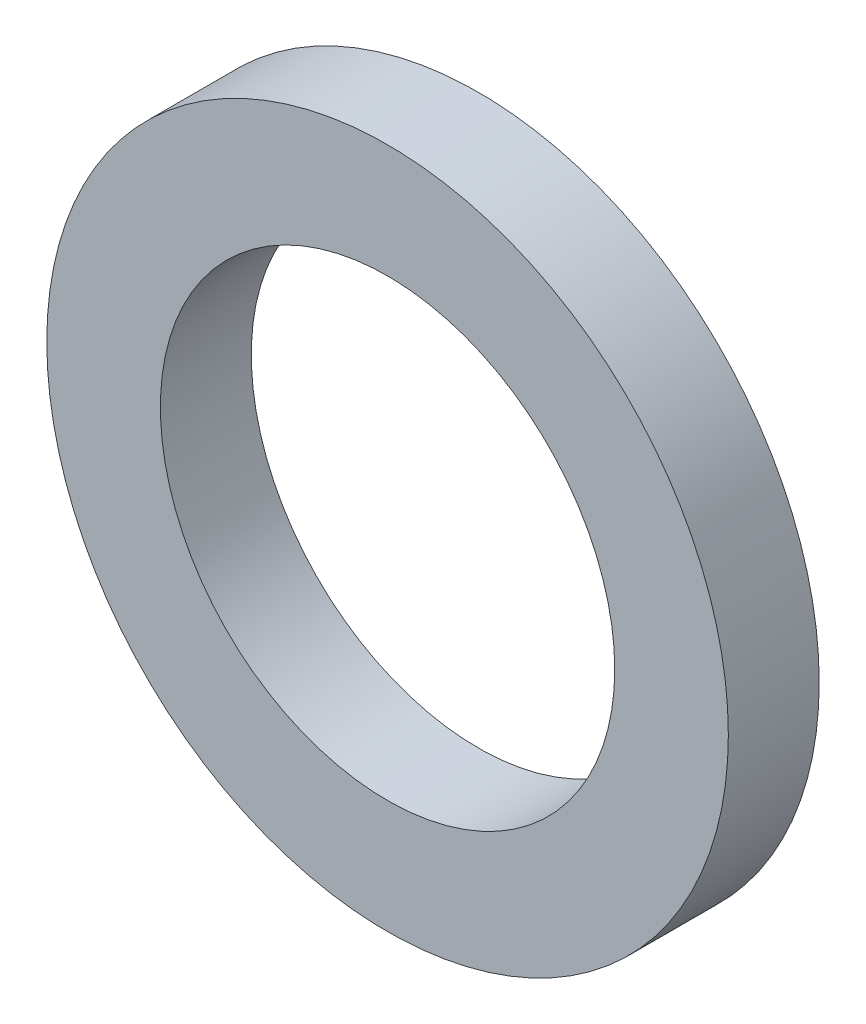
from build123d import *

# Parameters (mm, degrees)
SKETCH1_R           = 7.5
SKETCH1_R_2         = 5
BOSS_EXTRUDE1_DEPTH = 2


with BuildPart() as part:
    # Sketch1 → Boss-Extrude1 (new body)
    with BuildSketch(Plane.XY):
        Circle(SKETCH1_R)
        Circle(SKETCH1_R_2, mode=Mode.SUBTRACT)
    extrude(amount=BOSS_EXTRUDE1_DEPTH)


solid = part.part
